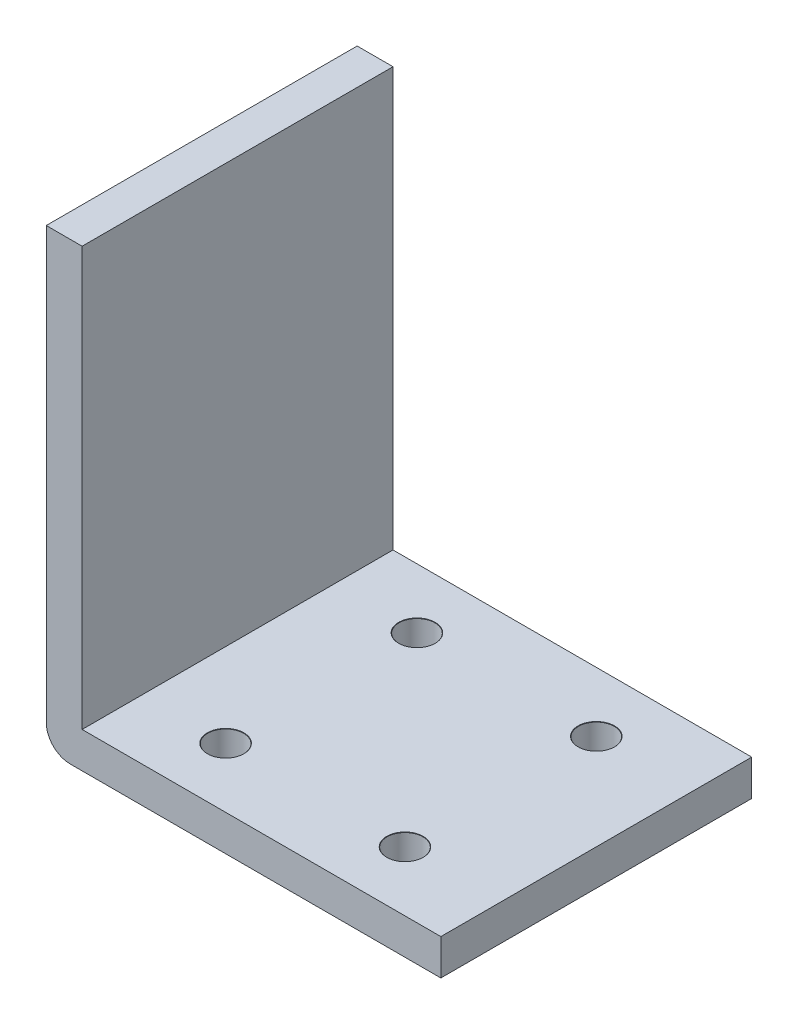
from build123d import *

# Parameters (mm, degrees)
SKETCH1_W                       = 33
SKETCH1_H                       = 26
BOSS_EXTRUDE1_DEPTH             = 3
SKETCH2_W                       = 3
SKETCH2_H                       = 26
BOSS_EXTRUDE2_DEPTH             = 35
FILLET1_R                       = 2
F_3_0MM_DOWEL_HOLE1_D           = 3
F_3_0MM_DOWEL_HOLE1_CSINK_D     = 3.05
F_3_0MM_DOWEL_HOLE1_CSINK_ANGLE = 90


with BuildPart() as part:
    # Sketch1 → Boss-Extrude1 (new body)
    with BuildSketch(Plane(origin=(0, 0, 0), x_dir=(1, 0, 0), z_dir=(0, 1, 0))):
        with Locations((16.5, 13)):
            Rectangle(SKETCH1_W, SKETCH1_H)
    extrude(amount=BOSS_EXTRUDE1_DEPTH)

    # Sketch2 → Boss-Extrude2 (add)
    with BuildSketch(Plane(origin=(0, 3, 0), x_dir=(1, 0, 0), z_dir=(0, 1, 0))):
        with Locations((1.5, 13)):
            Rectangle(SKETCH2_W, SKETCH2_H)
    extrude(amount=BOSS_EXTRUDE2_DEPTH)

    # Fillet1
    fillet1_edges = [part.edges().sort_by_distance(p)[0] for p in [
        (0, 0, -13),
    ]]
    fillet(fillet1_edges, radius=FILLET1_R)

    # Ø3.0mm Dowel Hole1 (through all)
    with Locations(Plane(origin=(0, 3, 0), x_dir=(1, 0, 0), z_dir=(0, 1, 0))):
        with Locations((25, 21), (10, 21), (25, 5), (10, 5)):
            CounterSinkHole(F_3_0MM_DOWEL_HOLE1_D / 2, F_3_0MM_DOWEL_HOLE1_CSINK_D / 2, counter_sink_angle=F_3_0MM_DOWEL_HOLE1_CSINK_ANGLE)


solid = part.part
